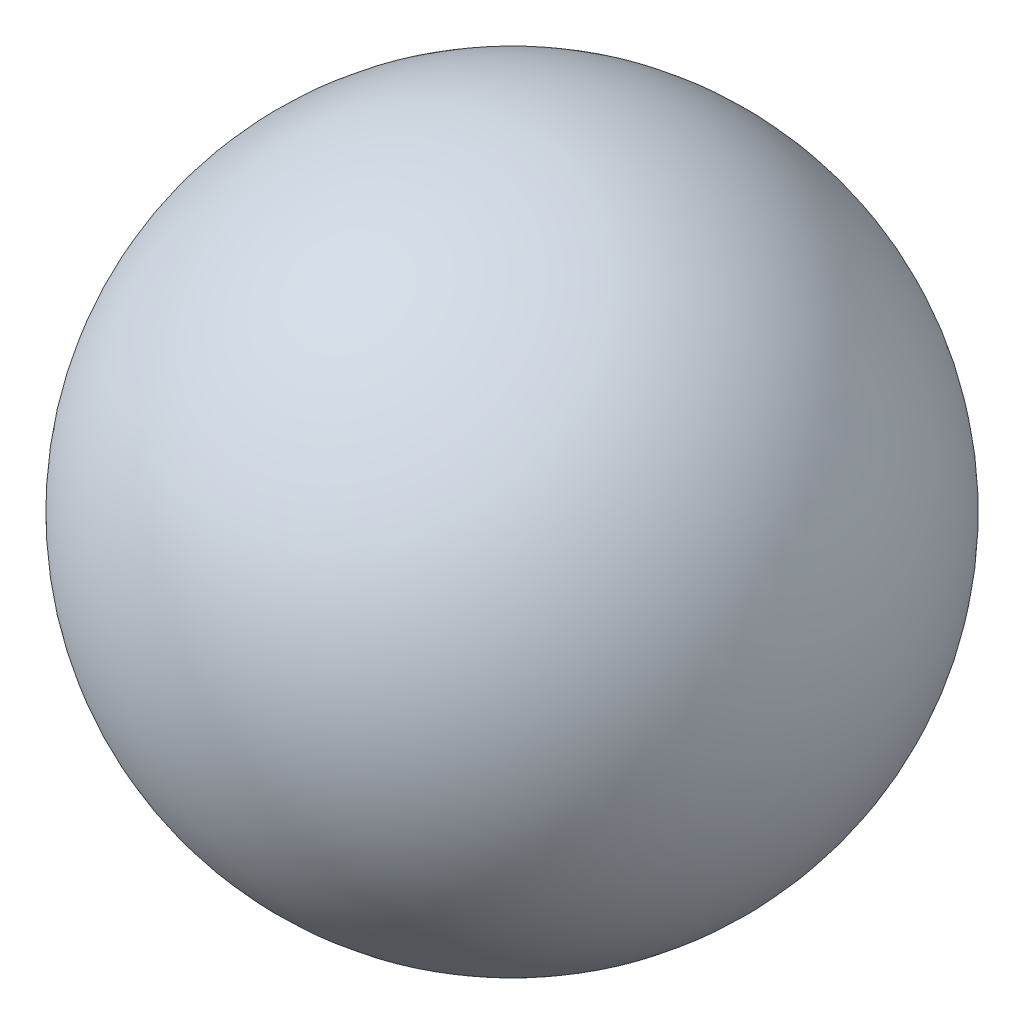
from build123d import *


with BuildPart() as part:
    # Sketch1 → Revolve1 (revolve)
    with BuildSketch(Plane.XY):
        with BuildLine():
            Line((0, 88.9), (0, -88.9))
            ThreePointArc((0, -88.9), (88.9, 0), (0, 88.9))
        make_face()
    revolve(axis=Axis((0, 88.9, 0), (0, -1, 0)))


solid = part.part
